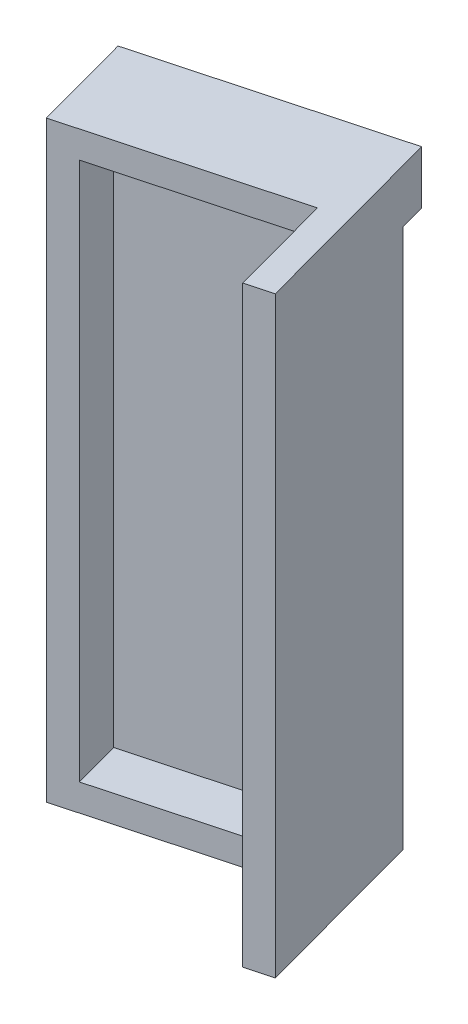
from build123d import *

# Parameters (mm, degrees)
CROQUIS1_W              = 52
CROQUIS1_H              = 37
SALIENTE_EXTRUIR1_DEPTH = 3
REDONDEO1_R             = 3
CROQUIS2_R              = 1.5
CORTAR_EXTRUIR1_DEPTH   = 3
CROQUIS3_W              = 29
CROQUIS3_H              = 20
CROQUIS3_W_2            = 6
CROQUIS3_H_2            = 14
CORTAR_EXTRUIR2_DEPTH   = 3
SALIENTE_EXTRUIR2_DEPTH = 9
CROQUIS5_W              = 36
CROQUIS5_H              = 28.002550662
SALIENTE_EXTRUIR3_DEPTH = 10.3
CORTAR_EXTRUIR3_START   = -28.002551
CORTAR_EXTRUIR3_DEPTH   = 28.002551
SALIENTE_EXTRUIR4_DEPTH = 8.5
CROQUIS8_W              = 21.9
CROQUIS8_H              = 60.9
CORTAR_EXTRUIR4_DEPTH   = 5.5
CORTAR_EXTRUIR5_DEPTH   = 9
CORTAR_EXTRUIR6_START   = -28.002551
CROQUIS12_W             = 9
CROQUIS12_H             = 1.570892211
CORTAR_EXTRUIR6_DEPTH   = 28.002551
CROQUIS13_W             = 3
CROQUIS13_H             = 67
SALIENTE_EXTRUIR5_DEPTH = 12
CORTAR_EXTRUIR7_START   = -28.002551
CROQUIS14_W             = 31
CROQUIS14_H             = 9
CORTAR_EXTRUIR7_DEPTH   = 28.002551
CROQUIS17_R             = 1.5
SALIENTE_EXTRUIR6_DEPTH = 9
CORTAR_EXTRUIR8_START   = -37
CROQUIS18_W             = 54.197150846
CROQUIS18_H             = 9
CORTAR_EXTRUIR8_DEPTH   = 37
CROQUIS20_W             = 28
CROQUIS20_H             = 6
SALIENTE_EXTRUIR7_DEPTH = 3
CROQUIS21_W             = 20
CROQUIS21_H             = 4.5
CORTAR_EXTRUIR10_DEPTH  = 2
CROQUIS24_W             = 0.05
CROQUIS24_H             = 60.9
CORTAR_EXTRUIR13_DEPTH  = 5.5
CROQUIS25_W             = 64.228743672
CROQUIS25_H             = 61
CORTAR_EXTRUIR14_DEPTH  = 15
CROQUIS26_W             = 10.904109589
CROQUIS26_H             = 37
CORTAR_EXTRUIR15_DEPTH  = 15


with BuildPart() as part:
    # Croquis1 → Saliente-Extruir1 (new body)
    with BuildSketch(Plane.XY):
        with Locations((-39.296803653, 6.787671233)):
            Rectangle(CROQUIS1_W, CROQUIS1_H)
    extrude(amount=SALIENTE_EXTRUIR1_DEPTH)

    # Redondeo1
    redondeo1_edges = [part.edges().sort_by_distance(p)[0] for p in [
        (-65.296803653, 25.287671233, 1.5),
        (-65.296803653, -11.712328767, 1.5),
    ]]
    fillet(redondeo1_edges, radius=REDONDEO1_R)

    # Croquis2 → Cortar-Extruir1 (cut)
    with BuildSketch(Plane.XY.offset(3)):
        with Locations((-61.296803653, 21.287671233)):
            Circle(CROQUIS2_R)
        with Locations((-61.296803653, -7.712328767)):
            Circle(CROQUIS2_R)
        with Locations((-16.624072342, -7.712328767)):
            Circle(CROQUIS2_R)
        with Locations((-17.296803653, 21.287671233)):
            Circle(CROQUIS2_R)
    extrude(amount=-CORTAR_EXTRUIR1_DEPTH, mode=Mode.SUBTRACT)

    # Croquis3 → Cortar-Extruir2 (cut)
    with BuildSketch(Plane.XY.offset(3)):
        with Locations((-50.796803653, 6.787671233)):
            Rectangle(CROQUIS3_W, CROQUIS3_H)
        with Locations((-16.296803653, 6.787671233)):
            Rectangle(CROQUIS3_W_2, CROQUIS3_H_2)
    extrude(amount=-CORTAR_EXTRUIR2_DEPTH, mode=Mode.SUBTRACT)

    # Croquis4 → Saliente-Extruir2 (add)
    with BuildSketch(Plane.XY.offset(3)):
        Polygon((-57.296803653, 16.787671233), (-57.296803653, 20.790221895), (-26.296803653, 20.790221895), (-26.296803653, -7.212328767), (-57.296803653, -7.212328767), (-57.296803653, -3.212328767), (-36.296803653, -3.212328767), (-36.296803653, 16.787671233), align=None)
    extrude(amount=SALIENTE_EXTRUIR2_DEPTH)

    # Croquis5 → Saliente-Extruir3 (add)
    with BuildSketch(Plane.XY.offset(12)):
        with Locations((-44.296803653, 6.788946564)):
            Rectangle(CROQUIS5_W, CROQUIS5_H)
    extrude(amount=SALIENTE_EXTRUIR3_DEPTH)

    # Croquis6 → Cortar-Extruir3 (cut)
    with BuildSketch(Plane.XZ.offset(7.212328767).offset(CORTAR_EXTRUIR3_START)):
        Polygon((-35.296803653, 15), (-35.296803653, 12.995381041), (-26.296803653, 12.995381041), (-26.296803653, 14.757444162), (-26.296803653, 22.3), (-62.296803653, 22.3), align=None)
    extrude(amount=CORTAR_EXTRUIR3_DEPTH, mode=Mode.SUBTRACT)

    # Croquis7 → Saliente-Extruir4 (add)
    with BuildSketch(Plane(origin=(1.374852463, 0, 5.085070754), x_dir=(0.9653390502996949, 0, -0.2609990765625102), z_dir=(0.2609990765625102, 0, 0.9653390502996949))):
        Polygon((-65.957816682, 6.788946564), (-65.957816682, -26.711053436), (-37.957816682, -26.711053436), (-37.957816682, 40.288946564), (-65.957816682, 40.288946564), align=None)
    extrude(amount=SALIENTE_EXTRUIR4_DEPTH)

    # Croquis8 → Cortar-Extruir4 (cut)
    with BuildSketch(Plane(origin=(3.593344614, 0, 13.290452681), x_dir=(0.9653390502996949, 0, -0.26099907656251026), z_dir=(0.26099907656251026, 0, 0.9653390502996949))):
        with Locations((-51.957816682, 6.788946564)):
            Rectangle(CROQUIS8_W, CROQUIS8_H)
    extrude(amount=-CORTAR_EXTRUIR4_DEPTH, mode=Mode.SUBTRACT)

    # Croquis10 → Cortar-Extruir5 (cut)
    with BuildSketch(Plane(origin=(0, 20.790221895, 0), x_dir=(1, 0, 0), z_dir=(0, 1, 0))):
        Polygon((-62.296803653, -22.3), (-35.296803653, -15), (-35.296803653, -12), (-62.296803653, -19.3), align=None)
    extrude(amount=-CORTAR_EXTRUIR5_DEPTH, mode=Mode.SUBTRACT)

    # Croquis12 → Cortar-Extruir6 (cut)
    with BuildSketch(Plane(origin=(0, 20.790221895, 0), x_dir=(1, 0, 0), z_dir=(0, 1, 0)).offset(CORTAR_EXTRUIR6_START)):
        with Locations((-30.796803653, -12.209934936)):
            Rectangle(CROQUIS12_W, CROQUIS12_H)
    extrude(amount=CORTAR_EXTRUIR6_DEPTH, mode=Mode.SUBTRACT)

    # Croquis13 → Saliente-Extruir5 (add)
    with BuildSketch(Plane(origin=(3.593344614, 0, 13.290452681), x_dir=(0.9653390502996949, 0, -0.26099907656251026), z_dir=(0.26099907656251026, 0, 0.9653390502996949))):
        with Locations((-39.457816682, 6.788946564)):
            Rectangle(CROQUIS13_W, CROQUIS13_H)
    extrude(amount=SALIENTE_EXTRUIR5_DEPTH)

    # Croquis14 → Cortar-Extruir7 (cut)
    with BuildSketch(Plane.XZ.offset(7.212328767).offset(CORTAR_EXTRUIR7_START)):
        with Locations((-41.796803653, 7.5)):
            Rectangle(CROQUIS14_W, CROQUIS14_H)
    extrude(amount=CORTAR_EXTRUIR7_DEPTH, mode=Mode.SUBTRACT)


with BuildPart() as cortar_extruir7_piece_1:
    # of the separate pieces the step leaves, piece 1, a body of its own (cortar_extruir7_pieces)
    add(part.part.solids().sort_by_distance((-62.296803653, -26.711053436, 22.3))[0])



with BuildPart() as cortar_extruir7_piece_2:
    # of the separate pieces the step leaves, piece 2, a body of its own (cortar_extruir7_pieces)
    add(part.part.solids().sort_by_distance((-62.296803653, 25.287671233, 3))[0])


with BuildPart() as cortar_extruir7_piece_1_1:
    add(cortar_extruir7_piece_1.part)

    add(cortar_extruir7_piece_2.part)  # Saliente-Extruir6 merges Cortar-Extruir7 piece 2
    # Croquis17 → Saliente-Extruir6 (add)
    with BuildSketch(Plane.XY.offset(3)):
        with BuildLine():
            Line((-13.296803653, -0.212328767), (-19.296803653, -0.212328767))
            Line((-19.296803653, -0.212328767), (-19.296803653, 13.787671233))
            Line((-19.296803653, 13.787671233), (-13.296803653, 13.787671233))
            Line((-13.296803653, 13.787671233), (-13.296803653, 25.287671233))
            Line((-13.296803653, 25.287671233), (-62.296803653, 25.287671233))
            ThreePointArc((-62.296803653, 25.287671233), (-64.418123997, 24.408991576), (-65.296803653, 22.287671233))
            Line((-65.296803653, 22.287671233), (-65.296803653, 16.787671233))
            Line((-65.296803653, 16.787671233), (-36.296803653, 16.787671233))
            Line((-36.296803653, 16.787671233), (-36.296803653, -3.212328767))
            Line((-36.296803653, -3.212328767), (-65.296803653, -3.212328767))
            Line((-65.296803653, -3.212328767), (-65.296803653, -8.712328767))
            ThreePointArc((-65.296803653, -8.712328767), (-64.418123997, -10.833649111), (-62.296803653, -11.712328767))
            Line((-62.296803653, -11.712328767), (-13.296803653, -11.712328767))
            Line((-13.296803653, -11.712328767), (-13.296803653, -0.212328767))
        make_face()
        with Locations((-61.296803653, 21.287671233)):
            Circle(CROQUIS17_R, mode=Mode.SUBTRACT)
        with Locations((-61.296803653, -7.712328767)):
            Circle(CROQUIS17_R, mode=Mode.SUBTRACT)
        with Locations((-16.624072342, -7.712328767)):
            Circle(CROQUIS17_R, mode=Mode.SUBTRACT)
        with Locations((-17.296803653, 21.287671233)):
            Circle(CROQUIS17_R, mode=Mode.SUBTRACT)
    extrude(amount=SALIENTE_EXTRUIR6_DEPTH)

    # Croquis18 → Cortar-Extruir8 (cut)
    with BuildSketch(Plane.XZ.offset(11.712328767).offset(CORTAR_EXTRUIR8_START)):
        with Locations((-40.395379076, 4.5)):
            Rectangle(CROQUIS18_W, CROQUIS18_H)
    extrude(amount=CORTAR_EXTRUIR8_DEPTH, mode=Mode.SUBTRACT)

    # Croquis20 → Saliente-Extruir7 (add)
    with BuildSketch(Plane(origin=(1.374852463, 0, 5.085070754), x_dir=(-0.9653390502996949, 0, 0.26099907656251026), z_dir=(-0.26099907656251026, 0, -0.9653390502996949))):
        with Locations((51.957816682, 37.288946564)):
            Rectangle(CROQUIS20_W, CROQUIS20_H)
    extrude(amount=SALIENTE_EXTRUIR7_DEPTH)

    # Croquis21 → Cortar-Extruir10 (cut)
    with BuildSketch(Plane(origin=(0, 0, 9), x_dir=(-1, 0, 0), z_dir=(0, 0, -1))):
        with Locations((45.296803653, 19.037671233)):
            Rectangle(CROQUIS21_W, CROQUIS21_H)
        with Locations((45.296803653, -5.462328767)):
            Rectangle(CROQUIS21_W, CROQUIS21_H)
    extrude(amount=-CORTAR_EXTRUIR10_DEPTH, mode=Mode.SUBTRACT)

    # Croquis24 → Cortar-Extruir13 (cut)
    with BuildSketch(Plane(origin=(3.593344614, 0, 13.290452681), x_dir=(0.9653390502996949, 0, -0.26099907656251026), z_dir=(0.26099907656251026, 0, 0.9653390502996949))):
        with Locations((-40.982816682, 6.788946564)):
            Rectangle(CROQUIS24_W, CROQUIS24_H)
    extrude(amount=-CORTAR_EXTRUIR13_DEPTH, mode=Mode.SUBTRACT)

    # Croquis25 → Cortar-Extruir14 (cut)
    with BuildSketch(Plane(origin=(1.374852463, 0, 5.085070754), x_dir=(-0.9653390502996949, 0, 0.26099907656251026), z_dir=(-0.26099907656251026, 0, -0.9653390502996949))):
        with Locations((45.297379558, 3.788946564)):
            Rectangle(CROQUIS25_W, CROQUIS25_H)
    extrude(amount=CORTAR_EXTRUIR14_DEPTH, mode=Mode.SUBTRACT)


with BuildPart() as cortar_extruir14_piece_1:
    # of the separate pieces the step leaves, piece 1, a body of its own (cortar_extruir14_pieces)
    add(cortar_extruir7_piece_1_1.part.solids().sort_by_distance((-62.296803653, -26.711053436, 22.3))[0])


with BuildPart() as cortar_extruir14_piece_2:
    # of the separate pieces the step leaves, piece 2, a body of its own (cortar_extruir14_pieces)
    add(cortar_extruir7_piece_1_1.part.solids().sort_by_distance((-24.200913242, -11.712328767, 12))[0])

    # Croquis26 → Cortar-Extruir15 (cut)
    with BuildSketch(Plane.XY.offset(12)):
        with Locations((-18.748858448, 6.787671233)):
            Rectangle(CROQUIS26_W, CROQUIS26_H)
    extrude(amount=-CORTAR_EXTRUIR15_DEPTH, mode=Mode.SUBTRACT)


solid = cortar_extruir14_piece_1.part
